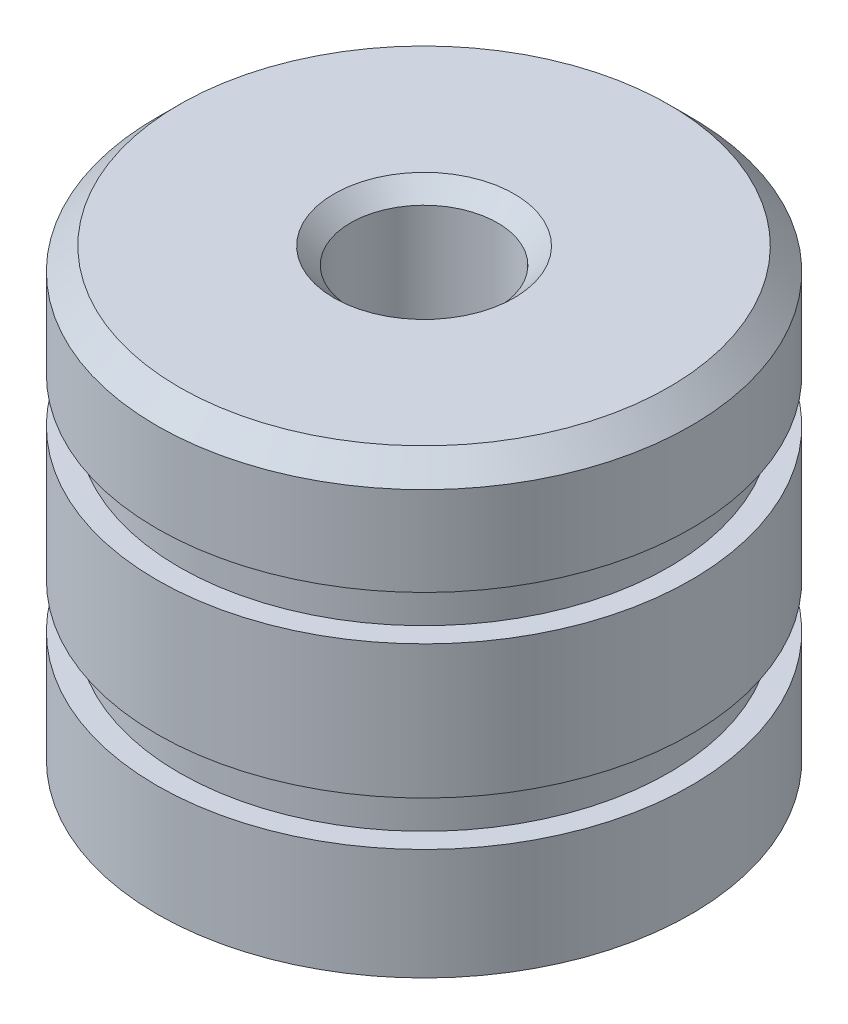
from build123d import *

# Parameters (mm, degrees)
SKETCH1_R                       = 6
BOSS_EXTRUDE1_DEPTH             = 5
CUT_EXTRUDE1_START              = -2.5
SKETCH2_R                       = 6
SKETCH2_R_2                     = 5.5
CUT_EXTRUDE1_DEPTH              = 1
CHAMFER1_SIZE                   = 0.5
M4X0_7_TAPPED_HOLE1_D           = 3.3
M4X0_7_TAPPED_HOLE1_DEPTH       = 8
M4X0_7_TAPPED_HOLE1_CSINK_D     = 4.05
M4X0_7_TAPPED_HOLE1_CSINK_ANGLE = 90
M4X0_7_TAPPED_HOLE1_TIP         = 0.991420021


with BuildPart() as part:
    # Sketch1 → Boss-Extrude1 (new, symmetric)
    with BuildSketch(Plane(origin=(0, 0, 0), x_dir=(1, 0, 0), z_dir=(0, 1, 0))):
        with Locations(Location((0, 0, 0), (0, 0, 270))):
            Circle(SKETCH1_R)
    extrude(amount=BOSS_EXTRUDE1_DEPTH, both=True)

    # Sketch2 → Cut-Extrude1 (cut)
    with BuildSketch(Plane(origin=(0, 5, 0), x_dir=(1, 0, 0), z_dir=(0, 1, 0)).offset(CUT_EXTRUDE1_START)):
        with Locations(Location((0, 0, 0), (0, 0, 270))):
            Circle(SKETCH2_R)
        with Locations(Location((0, 0, 0), (0, 0, 270))):
            Circle(SKETCH2_R_2, mode=Mode.SUBTRACT)
    cut_extrude1 = extrude(amount=-CUT_EXTRUDE1_DEPTH, mode=Mode.SUBTRACT)

    # Mirror1: Cut-Extrude1 across plane
    add(cut_extrude1.mirror(Plane.ZX), mode=Mode.SUBTRACT)

    # Chamfer1
    chamfer1_edges = [part.edges().sort_by_distance(p)[0] for p in [
        (0, 5, -6),
    ]]
    chamfer(chamfer1_edges, length=CHAMFER1_SIZE)

    # M4x0.7 Tapped Hole1
    with Locations(Plane(origin=(0, 5, 0), x_dir=(1, 0, 0), z_dir=(0, 1, 0))):
        with Locations((0, 0)):
            CounterSinkHole(M4X0_7_TAPPED_HOLE1_D / 2, M4X0_7_TAPPED_HOLE1_CSINK_D / 2, depth=M4X0_7_TAPPED_HOLE1_DEPTH, counter_sink_angle=M4X0_7_TAPPED_HOLE1_CSINK_ANGLE)
            with Locations((0, 0, -(M4X0_7_TAPPED_HOLE1_DEPTH + M4X0_7_TAPPED_HOLE1_TIP / 2))):  # 118° drill point
                Cone(0, M4X0_7_TAPPED_HOLE1_D / 2, M4X0_7_TAPPED_HOLE1_TIP, mode=Mode.SUBTRACT)


solid = part.part
